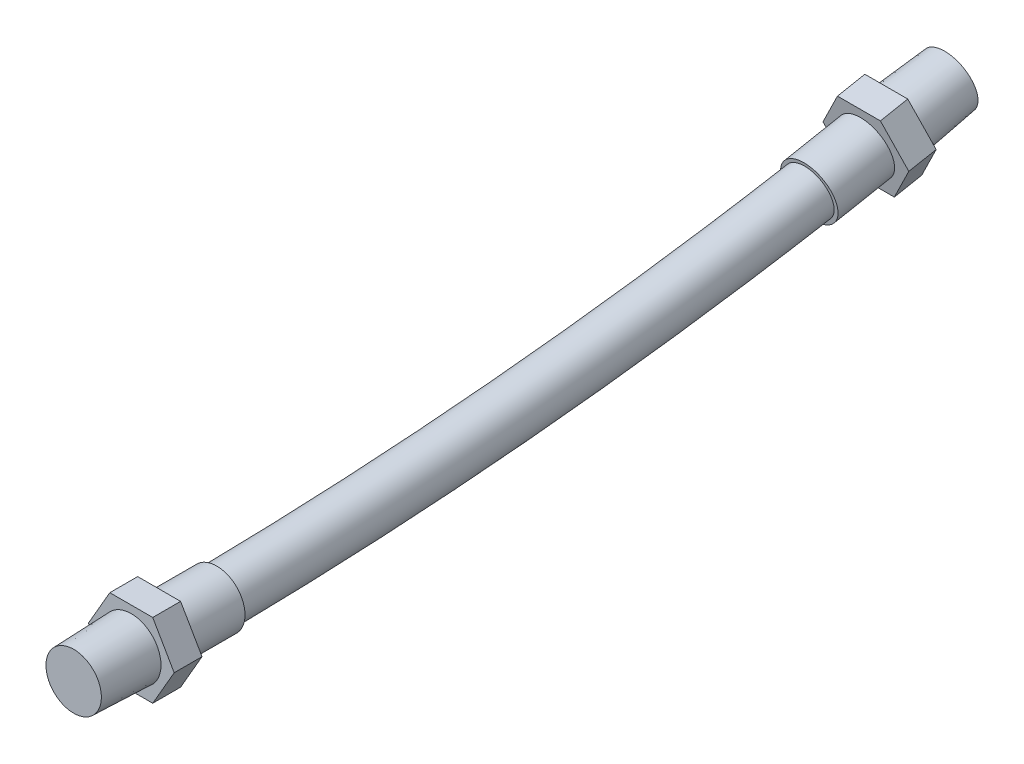
from build123d import *

# Parameters (mm, degrees)
SKETCH2_R           = 4.191
BOSS_EXTRUDE1_DEPTH = 4.7625
SKETCH4_R           = 5.08
BOSS_EXTRUDE2_DEPTH = 9.8425
BOSS_EXTRUDE2_TAPER = 2
SKETCH6_R           = 4.826
BOSS_EXTRUDE3_DEPTH = 9.8425


with BuildPart() as part:
    # Sweep1: sweep along a path in Sketch1
    with BuildLine(Plane(origin=(0, 0, 0), x_dir=(0, 0, -1), z_dir=(1, 0, 0))) as sweep1_path:
        ThreePointArc((0, 0), (60.651495576, 2.863871037), (120.763284, 11.43))
    # Sketch2 → Sweep1 (sweep)
    with BuildSketch(Plane.XY):
        Circle(SKETCH2_R)
    sweep(path=sweep1_path.line)

    # Sketch3 → Boss-Extrude1 (add)
    with BuildSketch(Plane.XY):
        Polygon((7.332348419, 0), (3.666174209, 6.35), (-3.666174209, 6.35), (-7.332348419, 0), (-3.666174209, -6.35), (3.666174209, -6.35), align=None)
    boss_extrude1 = extrude(amount=BOSS_EXTRUDE1_DEPTH)

    # Sketch4 → Boss-Extrude2 (add)
    with BuildSketch(Plane.XY.offset(4.7625)):
        Circle(SKETCH4_R)
    boss_extrude2 = extrude(amount=BOSS_EXTRUDE2_DEPTH, taper=BOSS_EXTRUDE2_TAPER)

    # Sketch6 → Boss-Extrude3 (add)
    with BuildSketch(Plane(origin=(0, 0, 0), x_dir=(-1, 0, 0), z_dir=(0, 0, -1))):
        with Locations(Location((0, 0, 0), (0, 0, 180))):
            Circle(SKETCH6_R)
    boss_extrude3 = extrude(amount=BOSS_EXTRUDE3_DEPTH)

    # Mirror1: Boss-Extrude1, Boss-Extrude2, Boss-Extrude3 across plane
    add(boss_extrude1.mirror(Plane(origin=(0, 5.715, -60.381642), x_dir=(1, 0, 0), z_dir=(0, 0.09422686028954569, -0.9955507514938526))))
    add(boss_extrude2.mirror(Plane(origin=(0, 5.715, -60.381642), x_dir=(1, 0, 0), z_dir=(0, 0.09422686028954569, -0.9955507514938526))))
    add(boss_extrude3.mirror(Plane(origin=(0, 5.715, -60.381642), x_dir=(1, 0, 0), z_dir=(0, 0.09422686028954569, -0.9955507514938526))))


solid = part.part
